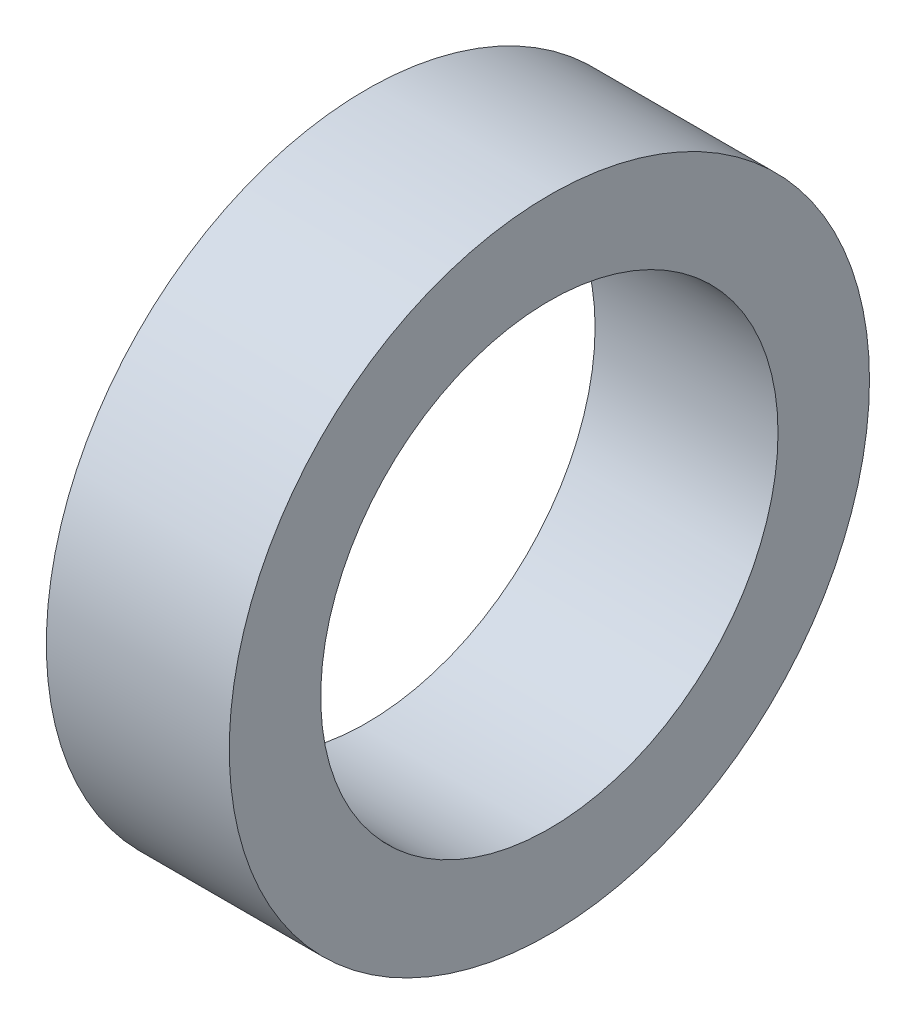
from build123d import *

# Parameters (mm, degrees)
SKETCH1_R           = 35
SKETCH1_R_2         = 25
BOSS_EXTRUDE1_DEPTH = 20


with BuildPart() as part:
    # Sketch1 → Boss-Extrude1 (new body)
    with BuildSketch(Plane(origin=(0, 0, 0), x_dir=(0, 0, -1), z_dir=(1, 0, 0))):
        Circle(SKETCH1_R)
        Circle(SKETCH1_R_2, mode=Mode.SUBTRACT)
    extrude(amount=BOSS_EXTRUDE1_DEPTH)


solid = part.part
